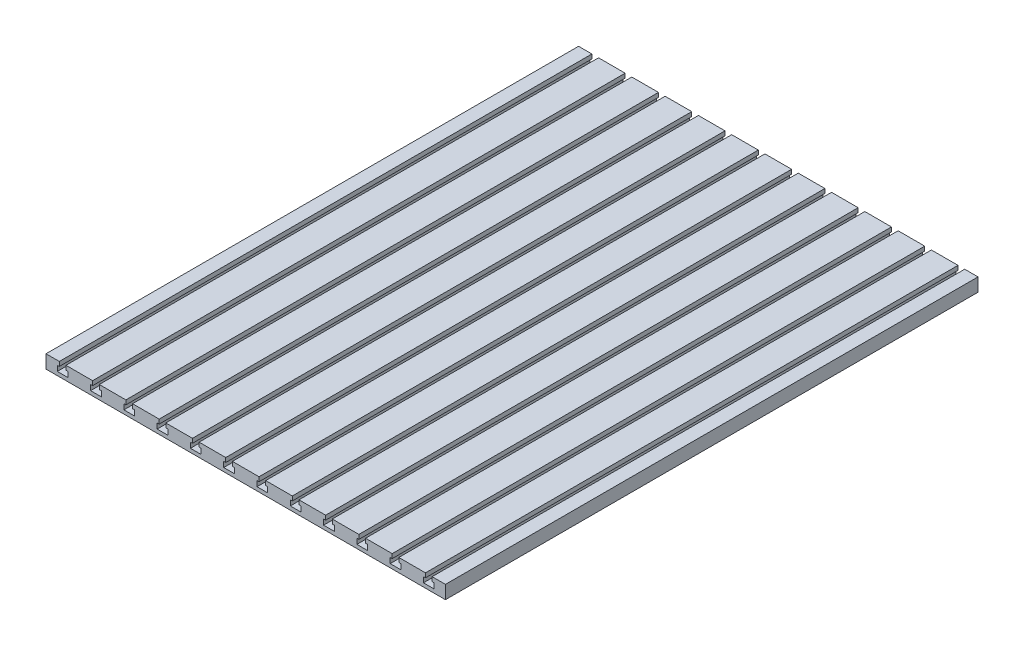
from build123d import *

# Parameters (mm, degrees)
SKETCH1_W           = 600
SKETCH1_H           = 20
BOSS_EXTRUDE1_DEPTH = 800
CUT_EXTRUDE1_DEPTH  = 1001.199980004


with BuildPart() as part:
    # Sketch1 → Boss-Extrude1 (new body)
    with BuildSketch(Plane.XY):
        with Locations((-300, 10)):
            Rectangle(SKETCH1_W, SKETCH1_H)
    extrude(amount=BOSS_EXTRUDE1_DEPTH)

    # Sketch2 → Cut-Extrude1 (cut, through all)
    with BuildSketch(Plane.XY.offset(800)):
        Polygon((-580, 20), (-580, 13.5), (-583, 13.5), (-583, 5.5), (-567, 5.5), (-567, 13.5), (-570, 13.5), (-570, 20), align=None)
        Polygon((-530, 20), (-530, 13.5), (-533, 13.5), (-533, 5.5), (-517, 5.5), (-517, 13.5), (-520, 13.5), (-520, 20), align=None)
        Polygon((-480, 20), (-480, 13.5), (-483, 13.5), (-483, 5.5), (-467, 5.5), (-467, 13.5), (-470, 13.5), (-470, 20), align=None)
        Polygon((-430, 20), (-430, 13.5), (-433, 13.5), (-433, 5.5), (-417, 5.5), (-417, 13.5), (-420, 13.5), (-420, 20), align=None)
        Polygon((-380, 20), (-380, 13.5), (-383, 13.5), (-383, 5.5), (-367, 5.5), (-367, 13.5), (-370, 13.5), (-370, 20), align=None)
        Polygon((-330, 20), (-330, 13.5), (-333, 13.5), (-333, 5.5), (-317, 5.5), (-317, 13.5), (-320, 13.5), (-320, 20), align=None)
        Polygon((-280, 20), (-280, 13.5), (-283, 13.5), (-283, 5.5), (-267, 5.5), (-267, 13.5), (-270, 13.5), (-270, 20), align=None)
        Polygon((-230, 20), (-230, 13.5), (-233, 13.5), (-233, 5.5), (-217, 5.5), (-217, 13.5), (-220, 13.5), (-220, 20), align=None)
        Polygon((-180, 20), (-180, 13.5), (-183, 13.5), (-183, 5.5), (-167, 5.5), (-167, 13.5), (-170, 13.5), (-170, 20), align=None)
        Polygon((-130, 20), (-130, 13.5), (-133, 13.5), (-133, 5.5), (-117, 5.5), (-117, 13.5), (-120, 13.5), (-120, 20), align=None)
        Polygon((-80, 20), (-80, 13.5), (-83, 13.5), (-83, 5.5), (-67, 5.5), (-67, 13.5), (-70, 13.5), (-70, 20), align=None)
        Polygon((-30, 20), (-30, 13.5), (-33, 13.5), (-33, 5.5), (-17, 5.5), (-17, 13.5), (-20, 13.5), (-20, 20), align=None)
    extrude(amount=-CUT_EXTRUDE1_DEPTH, mode=Mode.SUBTRACT)


solid = part.part
